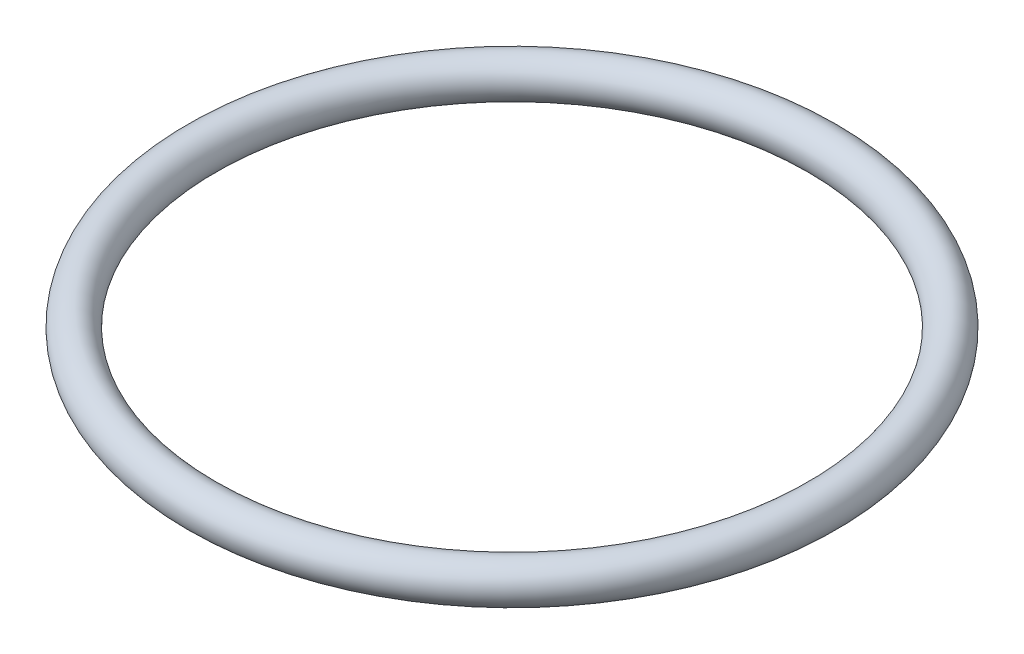
from build123d import *

# Parameters (mm, degrees)
CROQUIS2_R = 2.665


with BuildPart() as part:
    # Croquis2 → Revolución1 (revolve)
    with BuildSketch(Plane(origin=(0, 0, 0), x_dir=(0, 0, -1), z_dir=(1, 0, 0))):
        Circle(CROQUIS2_R)
    revolve(axis=Axis((0, 27.298475613, 42.035), (0, -1, 0)))


solid = part.part
